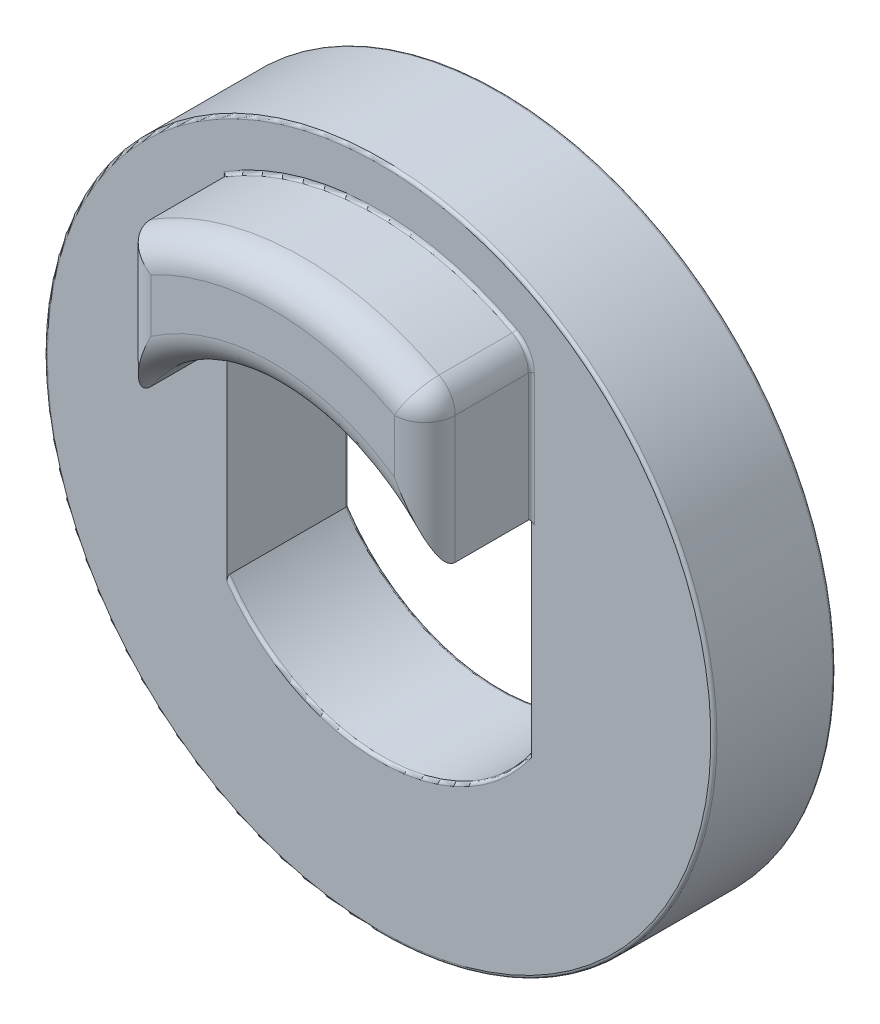
from build123d import *

# Parameters (mm, degrees)
SALIENTE_EXTRUIR1_DEPTH = 7.5
CORTAR_EXTRUIR1_DEPTH   = 3.5
REDONDEO1_R             = 1
REDONDEO2_R             = 0.1


with BuildPart() as part:
    # Croquis2 → Revolución1 (revolve)
    with BuildSketch(Plane(origin=(0, 0, 0), x_dir=(0, 0, -1), z_dir=(1, 0, 0)), mode=Mode.PRIVATE) as revoluci_n1_sk:
        Polygon((-7.5, 6), (0, 6), (0, 11), (-4, 11), (-4, 9.5), (-7.5, 9.5), align=None)
    revolve(revoluci_n1_sk.sketch.rotate(Axis((0, 0, 7.5), (0, 0, -1)), 90), axis=Axis((0, 0, 7.5), (0, 0, -1)))

    # Croquis3 → Saliente-Extruir1 (add, through all)
    with BuildSketch(Plane.XY.offset(7.5)):
        with BuildLine():
            ThreePointArc((6, 0), (5.744562647, 1.732050808), (5, 3.31662479))
            Line((5, 3.31662479), (5, -3.31662479))
            ThreePointArc((5, -3.31662479), (5.744562647, -1.732050808), (6, 0))
        make_face()
        with BuildLine():
            Line((-5, -3.31662479), (-5, 3.31662479))
            ThreePointArc((-5, 3.31662479), (-6, 0), (-5, -3.31662479))
        make_face()
    extrude(amount=-SALIENTE_EXTRUIR1_DEPTH)

    # Croquis4 → Cortar-Extruir1 (cut)
    with BuildSketch(Plane.XY.offset(7.5)):
        with BuildLine():
            ThreePointArc((9.5, 0), (8.299096336, 4.623310502), (5, 8.077747211))
            Line((5, 8.077747211), (5, 3.31662479))
            Line((5, 3.31662479), (5, -3.31662479))
            Line((5, -3.31662479), (5, -8.077747211))
            ThreePointArc((5, -8.077747211), (8.299096336, -4.623310502), (9.5, 0))
        make_face()
        with BuildLine():
            Line((-5, 3.31662479), (-5, 8.077747211))
            ThreePointArc((-5, 8.077747211), (-9.5, 0), (-5, -8.077747211))
            Line((-5, -8.077747211), (-5, -3.31662479))
            Line((-5, -3.31662479), (-5, 3.31662479))
        make_face()
        with BuildLine():
            Line((-5, -3.31662479), (-5, -8.077747211))
            Line((-5, -8.077747211), (5, -8.077747211))
            Line((5, -8.077747211), (5, -3.31662479))
            ThreePointArc((5, -3.31662479), (0, -6), (-5, -3.31662479))
        make_face()
        with BuildLine():
            Line((5, -8.077747211), (-5, -8.077747211))
            ThreePointArc((-5, -8.077747211), (0, -9.5), (5, -8.077747211))
        make_face()
    extrude(amount=-CORTAR_EXTRUIR1_DEPTH, mode=Mode.SUBTRACT)

    # Redondeo1
    redondeo1_edges = [part.edges().sort_by_distance(p)[0] for p in [
        (-5, 5.697186001, 7.5),
        (5, 5.697186001, 7.5),
        (5, 8.077747211, 5.75),
        (0, 6, 7.5),
        (0, 9.5, 7.5),
    ]]
    fillet(redondeo1_edges, radius=REDONDEO1_R)

    # Redondeo2
    redondeo2_edges = [part.edges().sort_by_distance(p)[0] for p in [
        (-0.30539379, 9.495090028, 4),
        (4.857492926, 8.014495755, 4),
        (0, -6, 4),
        (-5, 5.697186001, 4),
        (5, 5.408312395, 4),
        (-11, 0, 0),
        (-11, 0, 4),
        (-5, 0, 0),
        (5, 0, 0),
        (0, 6, 0),
        (0, -6, 0),
    ]]
    fillet(redondeo2_edges, radius=REDONDEO2_R)


solid = part.part
